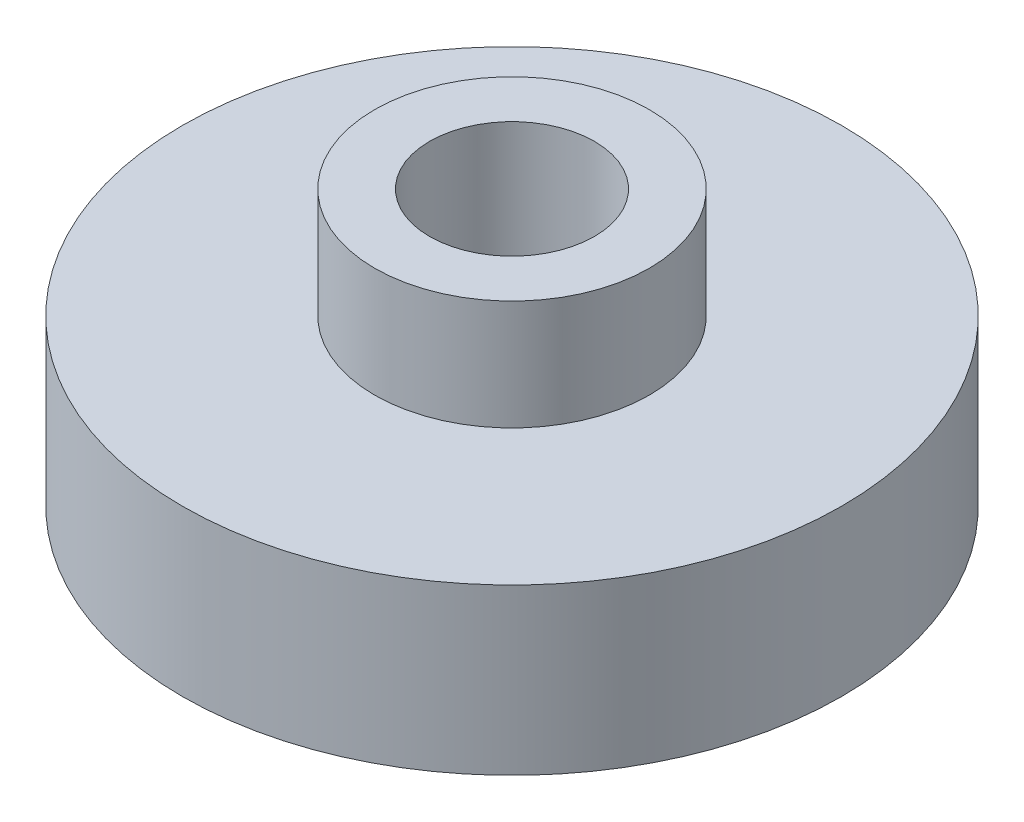
from build123d import *
from build123d.topology import SkipClean

# Parameters (mm, degrees)
SKETCH_1_R      = 2.5
SKETCH_1_R_2    = 1.5
EXTRUDE_1_DEPTH = 2
EXTRUDE_START   = 3
SKETCH_2_R      = 6
SKETCH_2_R_2    = 1.5
EXTRUDE_2_DEPTH = 3


with BuildPart() as part:
    # 草图1 → 凸台-拉伸1 (new body)
    with BuildSketch(Plane(origin=(0, 0, 0), x_dir=(1, 0, 0), z_dir=(0, 1, 0))):
        with Locations(Location((0, 0, 0), (0, 0, 270))):
            Circle(SKETCH_1_R)
        with Locations(Location((0, 0, 0), (0, 0, 270))):
            Circle(SKETCH_1_R_2, mode=Mode.SUBTRACT)
    extrude(amount=EXTRUDE_1_DEPTH)

    # 草图2 → 凸台-拉伸2 (add)
    with SkipClean():  # the faces are left unmerged after this step: merging them gives an invalid solid
        with BuildSketch(Plane.XZ.offset(EXTRUDE_START)):
            with Locations(Location((0, 0, 0), (0, 0, 270))):
                Circle(SKETCH_2_R)
            with Locations(Location((0, 0, 0), (0, 0, 270))):
                Circle(SKETCH_2_R_2, mode=Mode.SUBTRACT)
        extrude(amount=-EXTRUDE_2_DEPTH)


solid = part.part
